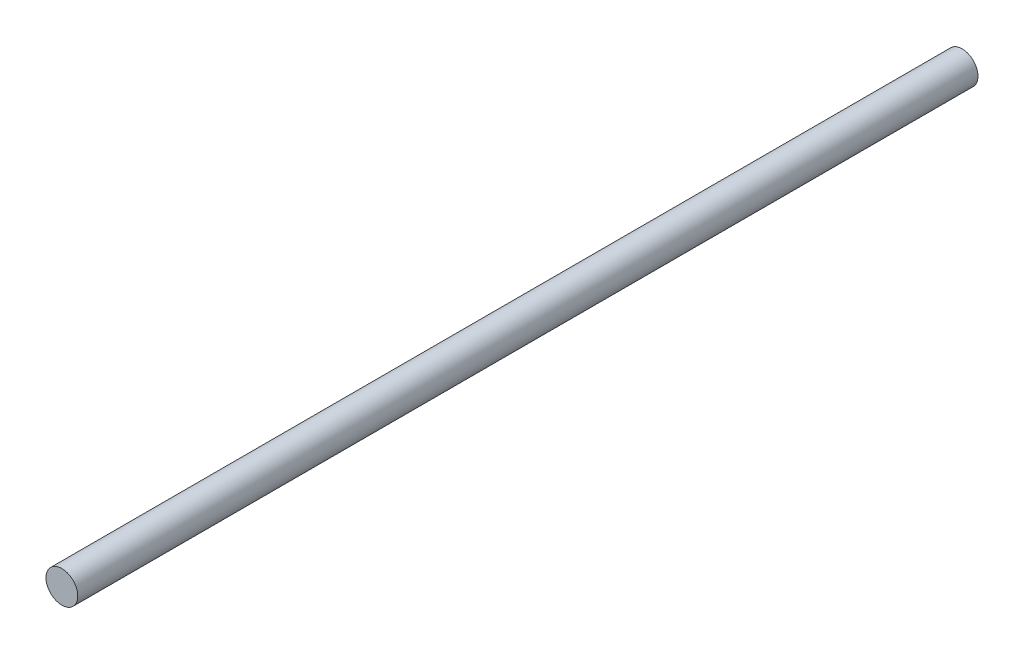
from build123d import *

# Parameters (mm, degrees)
SKETCH_1_R      = 3
EXTRUDE_1_DEPTH = 170


with BuildPart() as part:
    # 草图1 → 凸台-拉伸1 (new body)
    with BuildSketch(Plane.XY):
        Circle(SKETCH_1_R)
    extrude(amount=EXTRUDE_1_DEPTH)


solid = part.part
